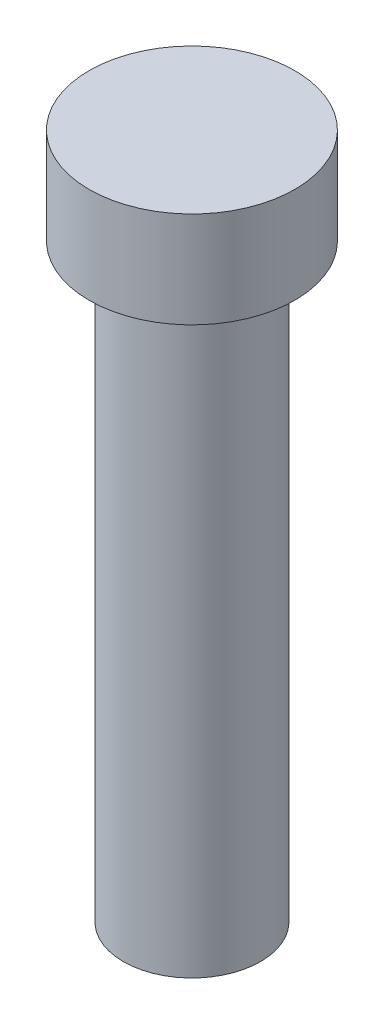
from build123d import *

# Parameters (mm, degrees)
SKETCH1_R           = 7.5
BOSS_EXTRUDE1_DEPTH = 7
SKETCH1_3_R         = 5
BOSS_EXTRUDE2_DEPTH = 43


with BuildPart() as part:
    # Sketch1 → Boss-Extrude1 (new body)
    with BuildSketch(Plane(origin=(0, 0, 0), x_dir=(1, 0, 0), z_dir=(0, 1, 0))):
        Circle(SKETCH1_R)
    extrude(amount=BOSS_EXTRUDE1_DEPTH)

    # Sketch1<3> → Boss-Extrude2 (add)
    with BuildSketch(Plane(origin=(0, 0, 0), x_dir=(1, 0, 0), z_dir=(0, 1, 0))):
        Circle(SKETCH1_3_R)
    extrude(amount=-BOSS_EXTRUDE2_DEPTH)


solid = part.part
